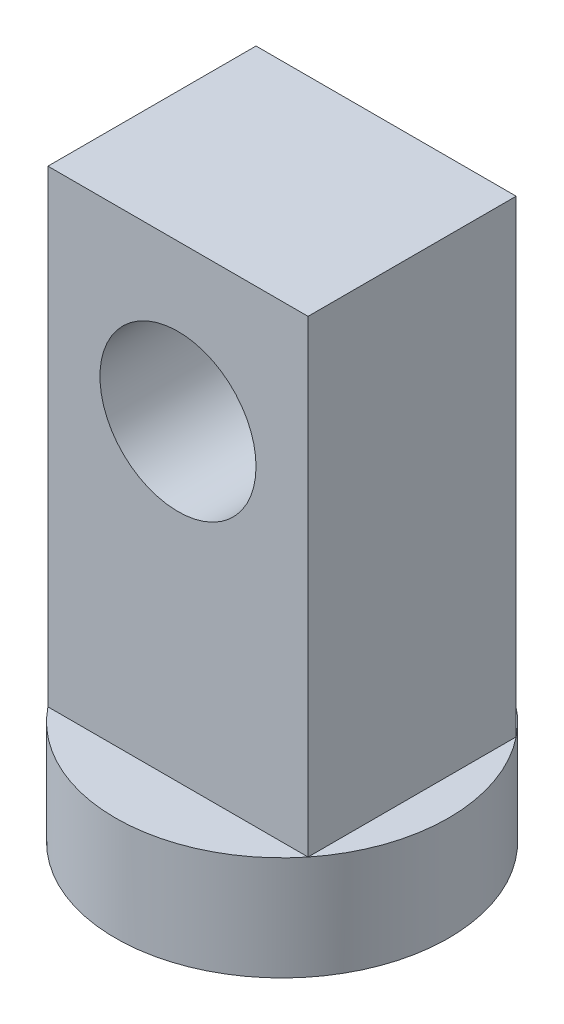
from build123d import *

# Parameters (mm, degrees)
SKETCH2_W           = 50
SKETCH2_H           = 110
SKETCH2_R           = 15
BOSS_EXTRUDE1_DEPTH = 20
SKETCH3_R           = 32.015621187
BOSS_EXTRUDE2_DEPTH = 20


with BuildPart() as part:
    # Sketch2 → Boss-Extrude1 (new, symmetric)
    with BuildSketch(Plane.XY):
        with Locations((0, -25)):
            Rectangle(SKETCH2_W, SKETCH2_H)
        Circle(SKETCH2_R, mode=Mode.SUBTRACT)
    extrude(amount=BOSS_EXTRUDE1_DEPTH, both=True)

    # Sketch3 → Boss-Extrude2 (add)
    with BuildSketch(Plane.XZ.offset(80)):
        with Locations(Location((0, 0, 0), (0, 0, 270))):
            Circle(SKETCH3_R)
    extrude(amount=-BOSS_EXTRUDE2_DEPTH)


solid = part.part
